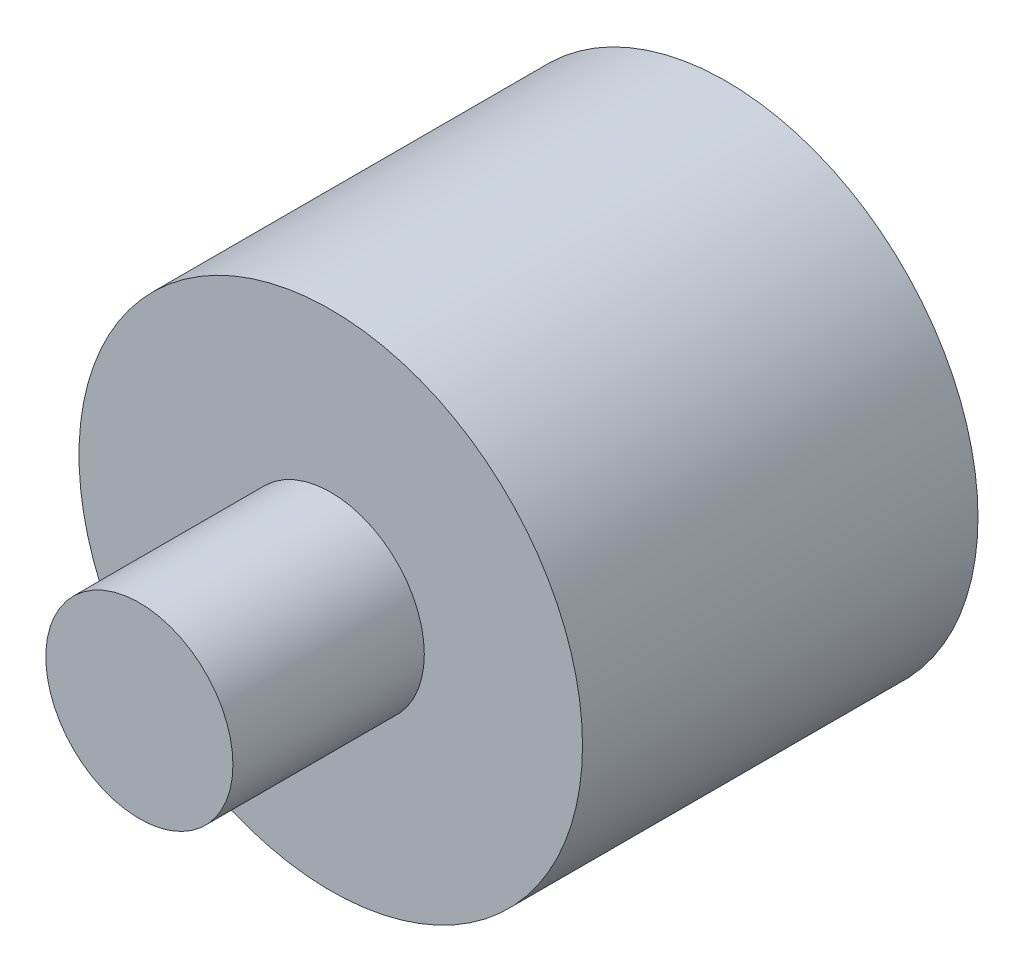
from build123d import *

# Parameters (mm, degrees)
SKETCH1_R           = 150.368
BOSS_EXTRUDE1_DEPTH = 236.22
SKETCH2_R           = 55.88
BOSS_EXTRUDE2_DEPTH = 114.3


with BuildPart() as part:
    # Sketch1 → Boss-Extrude1 (new body)
    with BuildSketch(Plane.XY):
        Circle(SKETCH1_R)
    extrude(amount=BOSS_EXTRUDE1_DEPTH)

    # Sketch2 → Boss-Extrude2 (add)
    with BuildSketch(Plane.XY.offset(236.22)):
        Circle(SKETCH2_R)
    extrude(amount=BOSS_EXTRUDE2_DEPTH)


solid = part.part
